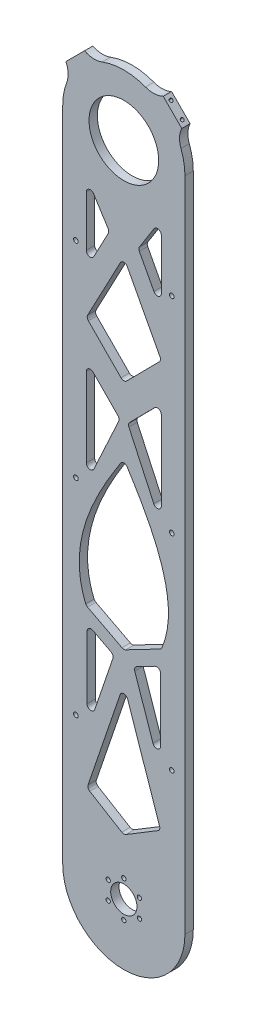
from build123d import *

# Parameters (mm, degrees)
SKETCH2_R                            = 10
SKETCH2_R_2                          = 1.65
BOSS_EXTRUDE1_DEPTH                  = 6.35
CUT_EXTRUDE1_DEPTH                   = 10
FILLET3_R                            = 3
SKETCH5_R                            = 1.75
CUT_EXTRUDE2_DEPTH                   = 549.511460792
SKETCH6_R                            = 26.5
CUT_EXTRUDE3_DEPTH                   = 10
BOSS_EXTRUDE2_START                  = -6.35
BOSS_EXTRUDE2_DEPTH                  = 6.35
TAP_DRILL_FOR_M3X0_5_TAP1_AT_2_COUNT = 2
TAP_DRILL_FOR_M3X0_5_TAP1_AT_2_PITCH = 12
CIRPATTERN2_COUNT                    = 2
CIRPATTERN2_ANGLE                    = 90


with BuildPart() as part:
    # Sketch2 → Boss-Extrude1 (new body)
    with BuildSketch(Plane.XY):
        with BuildLine():
            Line((-46.5, 0), (-46.5, 500))
            ThreePointArc((-46.5, 500), (0, 546.5), (46.5, 500))
            Line((46.5, 500), (46.5, 0))
            ThreePointArc((46.5, 0), (0, -46.5), (-46.5, 0))
        make_face()
        Circle(SKETCH2_R, mode=Mode.SUBTRACT)
        with Locations((0, 13.75)):
            Circle(SKETCH2_R_2, mode=Mode.SUBTRACT)
        with Locations((11.907849302, 6.875)):
            Circle(SKETCH2_R_2, mode=Mode.SUBTRACT)
        with Locations((11.907849302, -6.875)):
            Circle(SKETCH2_R_2, mode=Mode.SUBTRACT)
        with Locations((0, -13.75)):
            Circle(SKETCH2_R_2, mode=Mode.SUBTRACT)
        with Locations((-11.907849302, -6.875)):
            Circle(SKETCH2_R_2, mode=Mode.SUBTRACT)
        with Locations((-11.907849302, 6.875)):
            Circle(SKETCH2_R_2, mode=Mode.SUBTRACT)
    extrude(amount=BOSS_EXTRUDE1_DEPTH)

    # Sketch4 → Cut-Extrude1 (cut)
    with BuildSketch(Plane.XY.offset(6.35)):
        Polygon((28.005258112, 59.37595418), (0, 42.411661153), (-28.005258112, 59.37595418), (0, 141.693437584), align=None)
        Polygon((-7.5, 156.905935087), (-28.005258112, 96.633637735), (-28.005258112, 167.582877854), align=None)
        Polygon((28.005258112, 167.582877854), (7.5, 156.905935087), (28.005258112, 96.633637735), align=None)
        with BuildLine():
            Line((0, 164.275138905), (28.550546746, 179.141206521))
            add(Edge.make_bspline(
                [(28.550546746, 179.141206521), (45.32025339, 216.985654627), (19.430092874, 259.790255689), (0, 290.025756679)],
                knots=[0, 0, 0, 0, 1, 1, 1, 1], degree=3))
            add(Edge.make_bspline(
                [(-28.550546746, 179.141206521), (-45.32025339, 216.985654627), (-19.430092874, 259.790255689), (0, 290.025756679)],
                knots=[0, 0, 0, 0, 1, 1, 1, 1], degree=3))
            Line((-28.550546746, 179.141206521), (0, 164.275138905))
        make_face()
        Polygon((28.550546746, 259.58677623), (3, 314.938284003), (28.550546746, 340.793051053), align=None)
        Polygon((-3, 314.938284003), (-28.550546746, 340.793051053), (-28.550546746, 259.58677623), align=None)
        Polygon((0, 423.142843498), (-28.550546746, 369.246205395), (0, 340.355718526), (28.550546746, 369.246205395), align=None)
        Polygon((-28.550546746, 462.095190817), (-28.550546746, 401.290241252), (-11, 434.421497018), align=None)
        Polygon((28.550546746, 401.290241252), (11, 434.421497018), (28.550546746, 462.095190817), align=None)
    extrude(amount=-CUT_EXTRUDE1_DEPTH, mode=Mode.SUBTRACT)

    # Fillet3
    fillet3_edges = [part.edges().sort_by_distance(p)[0] for p in [
        (-11, 434.421497018, 3.175),
        (-28.550546746, 401.290241252, 3.175),
        (28.550546746, 401.290241252, 3.175),
        (11, 434.421497018, 3.175),
        (28.550546746, 462.095190817, 3.175),
        (-28.550546746, 462.095190817, 3.175),
        (0, 423.142843498, 3.175),
        (-28.550546746, 369.246205395, 3.175),
        (28.550546746, 369.246205395, 3.175),
        (0, 340.355718526, 3.175),
        (28.550546746, 340.793051053, 3.175),
        (-28.550546746, 340.793051053, 3.175),
        (-3, 314.938284003, 3.175),
        (3, 314.938284003, 3.175),
        (28.550546746, 259.58677623, 3.175),
        (-28.550546746, 259.58677623, 3.175),
        (28.550546746, 179.141206521, 3.175),
        (0, 290.025756679, 3.175),
        (-28.550546746, 179.141206521, 3.175),
        (0, 164.275138905, 3.175),
        (-28.005258112, 96.633637735, 3.175),
        (28.005258112, 96.633637735, 3.175),
        (7.5, 156.905935087, 3.175),
        (-28.005258112, 167.582877854, 3.175),
        (28.005258112, 167.582877854, 3.175),
        (0, 141.693437584, 3.175),
        (28.005258112, 59.37595418, 3.175),
        (-28.005258112, 59.37595418, 3.175),
        (0, 42.411661153, 3.175),
        (-7.5, 156.905935087, 3.175),
    ]]
    fillet(fillet3_edges, radius=FILLET3_R)

    # Sketch5 → Cut-Extrude2 (cut, through all)
    with BuildSketch(Plane.XY.offset(6.35)):
        with Locations((36.5, 103.175)):
            Circle(SKETCH5_R)
        with Locations(Location((-36.5, 103.175, 0), (0, 0, 180))):
            Circle(SKETCH5_R)
        with Locations(Location((36.5, 259.525, 0), (0, 0, 180))):
            Circle(SKETCH5_R)
        with Locations((-36.5, 259.525)):
            Circle(SKETCH5_R)
        with Locations((36.5, 415.875)):
            Circle(SKETCH5_R)
        with Locations(Location((-36.5, 415.875, 0), (0, 0, 180))):
            Circle(SKETCH5_R)
    extrude(amount=-CUT_EXTRUDE2_DEPTH, mode=Mode.SUBTRACT)

    # Sketch6 → Cut-Extrude3 (cut)
    with BuildSketch(Plane.XY.offset(6.35)):
        with Locations((0, 500)):
            Circle(SKETCH6_R)
    extrude(amount=-CUT_EXTRUDE3_DEPTH, mode=Mode.SUBTRACT)

    # Sketch7 → Boss-Extrude2 (add)
    with BuildSketch(Plane.XY.offset(6.35).offset(BOSS_EXTRUDE2_START)):
        with BuildLine():
            Line((44.110383395, 529.968247771), (29.968247771, 544.110383395))
            ThreePointArc((29.968247771, 544.110383395), (23.286397782, 542.399293624), (16.474718596, 543.483717035))
            ThreePointArc((16.474718596, 543.483717035), (32.880465325, 532.880465325), (43.483717035, 516.474718596))
            ThreePointArc((43.483717035, 516.474718596), (42.399293624, 523.286397782), (44.110383395, 529.968247771))
        make_face()
    boss_extrude2 = extrude(amount=BOSS_EXTRUDE2_DEPTH)

    # Sketch9 → Tap Drill for M3x0.5 Tap1 (revolve, cut)
    with BuildSketch(Plane(origin=(32.796674896, 541.28195627, 3.175), x_dir=(-0.7071067811865481, 0.7071067811865469, 0), z_dir=(0, 0, 1))):
        Polygon((0, 0), (0, 5.751075774), (1.25, 5), (1.25, 0), align=None)
    tap_drill_for_m3x0_5_tap1 = revolve(axis=Axis((37.286802956, 545.772084331, 3.175), (-0.7071067811865468, -0.7071067811865482, 0)), mode=Mode.SUBTRACT)

    # Tap Drill for M3x0.5 Tap1 at 2: Tap Drill for M3x0.5 Tap1 ×2
    with Locations(*[Vector(0.7071067811865482, -0.7071067811865468, 0) * (i * TAP_DRILL_FOR_M3X0_5_TAP1_AT_2_PITCH) for i in range(1, TAP_DRILL_FOR_M3X0_5_TAP1_AT_2_COUNT)]):
        add(tap_drill_for_m3x0_5_tap1, mode=Mode.SUBTRACT)

    # CirPattern2: Boss-Extrude2, Tap Drill for M3x0.5 Tap1 ×2 about axis
    cirpattern2_axis = Axis((0, 500, 0), (0, 0, 1))
    add([boss_extrude2.rotate(cirpattern2_axis, i * CIRPATTERN2_ANGLE / (CIRPATTERN2_COUNT - 1)) for i in range(1, CIRPATTERN2_COUNT)])
    add([tap_drill_for_m3x0_5_tap1.rotate(cirpattern2_axis, i * CIRPATTERN2_ANGLE / (CIRPATTERN2_COUNT - 1)) for i in range(1, CIRPATTERN2_COUNT)], mode=Mode.SUBTRACT)

    # CirPattern2 copy 1 sketch → CirPattern2 copy 1 (revolve, cut)
    with BuildSketch(Plane(origin=(-32.796674896, 541.28195627, 3.175), x_dir=(-0.7071067811865445, -0.7071067811865506, 0), z_dir=(0, 0, 1))):
        Polygon((0, 0), (0, 5.751075774), (1.25, 5), (1.25, 0), align=None)
    revolve(axis=Axis((-37.286802956, 545.772084331, 3.175), (0.7071067811865507, -0.7071067811865444, 0)), mode=Mode.SUBTRACT)


solid = part.part
